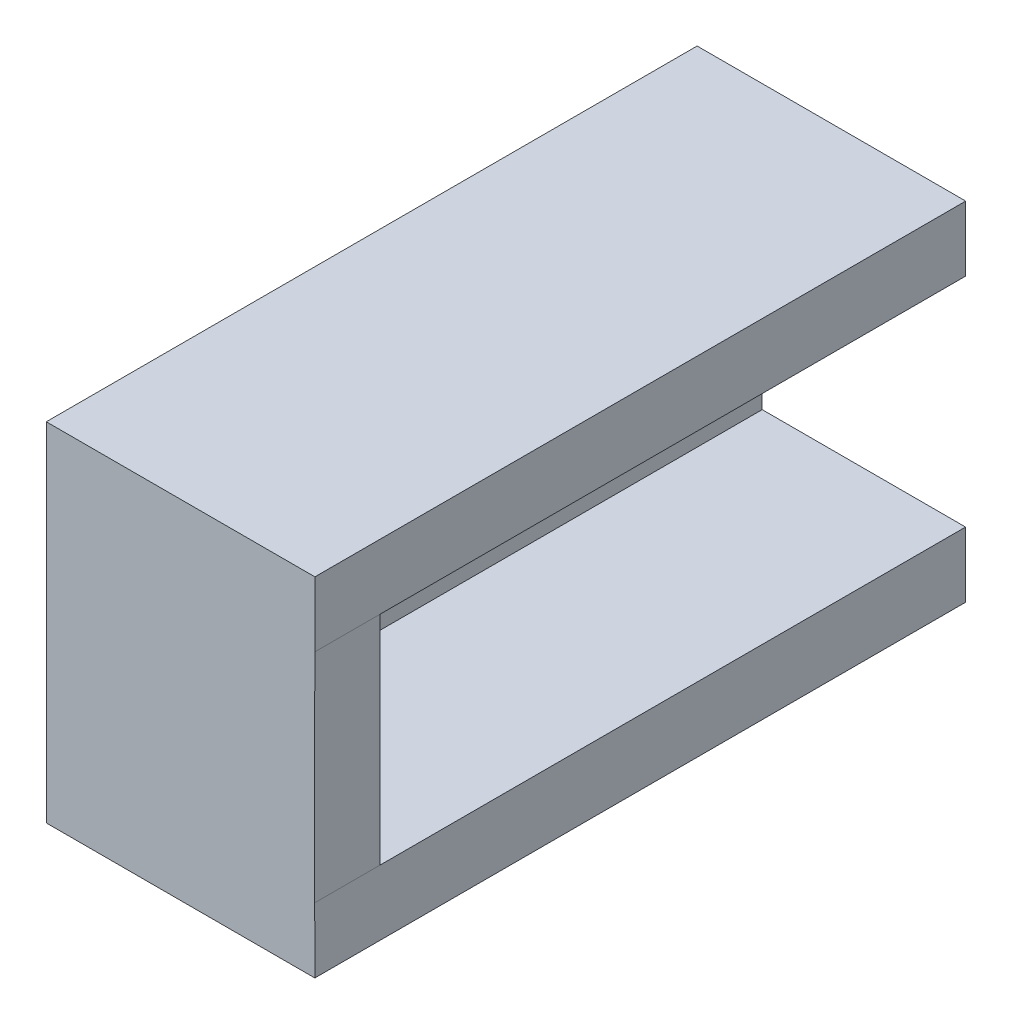
from build123d import *

# Parameters (mm, degrees)
BOSS_EXTRUDE1_DEPTH      = 25.4
BOSS_EXTRUDE1_DEPTH_BACK = 228.6
BOSS_EXTRUDE2_DEPTH      = 25.4


with BuildPart() as part:
    # Sketch2 → Boss-Extrude1 (new, two sides: drawn at the far end of the back side and taken through both)
    with BuildSketch(Plane.XY.offset(-BOSS_EXTRUDE1_DEPTH_BACK)):
        Polygon((-1498.565662295, -201.179604763), (-1393.765822295, -201.179604763), (-1393.800822295, -175.779604763), (-1473.165662295, -175.779604763), (-1473.165662295, -90.979604763), (-1393.790662295, -90.979604763), (-1393.740982295, -65.579604763), (-1498.565662295, -65.579604763), align=None)
    extrude(amount=BOSS_EXTRUDE1_DEPTH + BOSS_EXTRUDE1_DEPTH_BACK)

    # Sketch2<3> → Boss-Extrude2 (add)
    with BuildSketch(Plane.XY):
        Polygon((-1473.165662295, -175.779604763), (-1393.800822295, -175.779604763), (-1393.790662295, -90.979604763), (-1473.165662295, -90.979604763), align=None)
    extrude(amount=BOSS_EXTRUDE2_DEPTH)


solid = part.part
